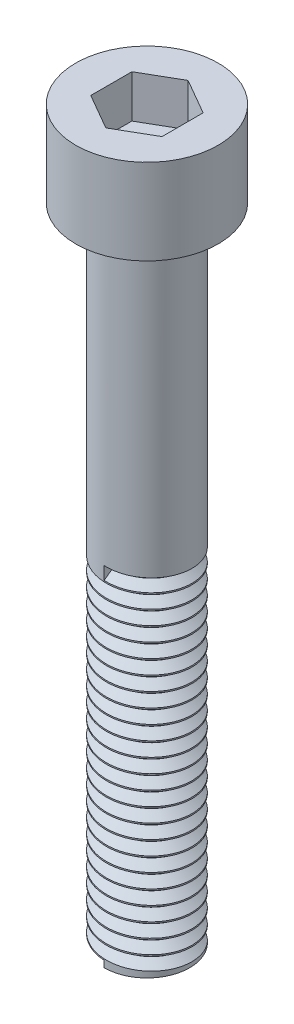
from build123d import *

# Parameters (mm, degrees)
SK_CABEZA_R         = 5
CABEZA_DEPTH        = 6
CANA_START          = -45
SK_CANA_R           = 3
CANA_DEPTH          = 45
HUECO_ALLEN_DEPTH   = 3
ROSCA_M6X1_0_PITCH  = 1
ROSCA_M6X1_0_HEIGHT = 24
ROSCA_M6X1_0_RADIUS = 3


with BuildPart() as part:
    # Sk_Cabeza → Cabeza (new body)
    with BuildSketch(Plane(origin=(0, 0, 0), x_dir=(1, 0, 0), z_dir=(0, 1, 0))):
        with Locations(Location((0, 0, 0), (0, 0, 270))):
            Circle(SK_CABEZA_R)
    extrude(amount=CABEZA_DEPTH)

    # Sk_Cana → Cana (add)
    with BuildSketch(Plane(origin=(0, 0, 0), x_dir=(1, 0, 0), z_dir=(0, 1, 0)).offset(CANA_START)):
        with Locations(Location((0, 0, 0), (0, 0, 90))):
            Circle(SK_CANA_R)
    extrude(amount=CANA_DEPTH)

    # Sk_Hueco_Allen → Hueco_Allen (cut)
    with BuildSketch(Plane(origin=(0, 6, 0), x_dir=(1, 0, 0), z_dir=(0, 1, 0))):
        Polygon((2.5, -1.443375673), (0, -2.886751346), (-2.5, -1.443375673), (-2.5, 1.443375673), (0, 2.886751346), (2.5, 1.443375673), align=None)
    extrude(amount=-HUECO_ALLEN_DEPTH, mode=Mode.SUBTRACT)

    # Rosca_M6x1,0: sweep along a helix
    with BuildLine() as rosca_m6x1_0_path:
        Helix(ROSCA_M6X1_0_PITCH, ROSCA_M6X1_0_HEIGHT, ROSCA_M6X1_0_RADIUS, center=(0, -45, 0), direction=(0, 1, 0), lefthand=True)
    # Sk_Perfil_rosca → Rosca_M6x1,0 (sweep, cut)
    with BuildSketch(Plane(origin=(0, 0, 0), x_dir=(0, 0, -1), z_dir=(1, 0, 0))):
        Polygon((-3.2, -45.6), (-2.3866, -45), (-3.2, -44.4), align=None)
    sweep(path=rosca_m6x1_0_path.line, is_frenet=True, mode=Mode.SUBTRACT)


solid = part.part
